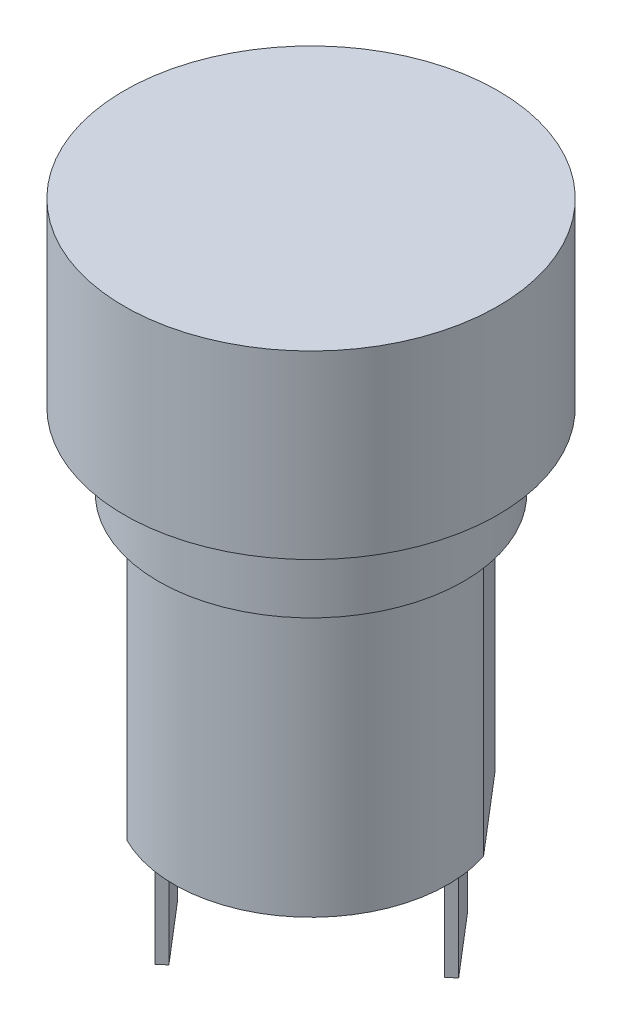
from build123d import *

# Parameters (mm, degrees)
SKETCH1_R           = 11
BOSS_EXTRUDE1_DEPTH = 21.7
SKETCH7_R           = 12.25
BOSS_EXTRUDE6_DEPTH = 6
SKETCH8_R           = 15
BOSS_EXTRUDE7_DEPTH = 14.5
CUT_EXTRUDE4_DEPTH  = 21.7
BOSS_EXTRUDE8_DEPTH = 9.3


with BuildPart() as part:
    # Sketch1 → Boss-Extrude1 (new body)
    with BuildSketch(Plane(origin=(0, 0, 0), x_dir=(1, 0, 0), z_dir=(0, 1, 0))):
        with Locations(Location((0, 0, 0), (0, 0, 270))):
            Circle(SKETCH1_R)
    extrude(amount=BOSS_EXTRUDE1_DEPTH)

    # Sketch7 → Boss-Extrude6 (add)
    with BuildSketch(Plane(origin=(0, 21.7, 0), x_dir=(1, 0, 0), z_dir=(0, 1, 0))):
        with Locations(Location((0, 0, 0), (0, 0, 270))):
            Circle(SKETCH7_R)
    extrude(amount=BOSS_EXTRUDE6_DEPTH)

    # Sketch8 → Boss-Extrude7 (add)
    with BuildSketch(Plane(origin=(0, 27.7, 0), x_dir=(1, 0, 0), z_dir=(0, 1, 0))):
        with Locations(Location((0, 0, 0), (0, 0, 90))):
            Circle(SKETCH8_R)
    extrude(amount=BOSS_EXTRUDE7_DEPTH)

    # Sketch3 → Cut-Extrude4 (cut)
    with BuildSketch(Plane.XZ):
        with BuildLine():
            Line((-4.958555581, 9.818998246), (-10.469742362, 3.374091709))
            ThreePointArc((-10.469742362, 3.374091709), (-8.360161447, 7.148965), (-4.958555581, 9.818998246))
        make_face()
        with BuildLine():
            Line((10.469742362, -3.374091709), (4.958555581, -9.818998246))
            ThreePointArc((4.958555581, -9.818998246), (8.360161447, -7.148965), (10.469742362, -3.374091709))
        make_face()
    extrude(amount=-CUT_EXTRUDE4_DEPTH, mode=Mode.SUBTRACT)

    # Sketch9 → Boss-Extrude8 (add)
    with BuildSketch(Plane.XZ):
        Polygon((8.013326492, -2.707706192), (8.621338234, -3.227630919), (4.526931006, -8.015723384), (3.918919265, -7.495798657), align=None)
        Polygon((-3.918903937, 7.495816582), (-4.526915678, 8.015741309), (-8.621322906, 3.227648844), (-8.013311164, 2.707724116), align=None)
    extrude(amount=BOSS_EXTRUDE8_DEPTH)


solid = part.part
